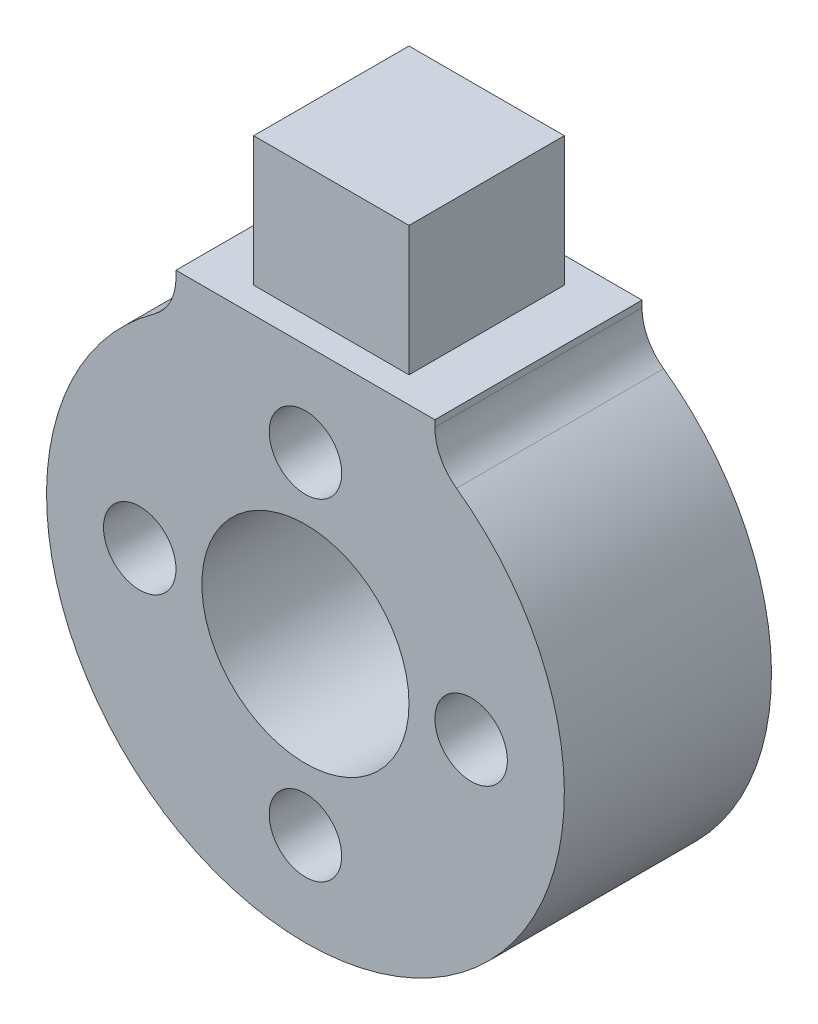
from build123d import *

# Parameters (mm, degrees)
SKETCH1_R           = 5.08
SKETCH1_R_2         = 1.778
BOSS_EXTRUDE1_DEPTH = 10.16
FILLET1_R           = 2.54
SKETCH2_W           = 7.62
SKETCH2_H           = 7.62
BOSS_EXTRUDE3_DEPTH = 6.35


with BuildPart() as part:
    # Sketch1 → Boss-Extrude1 (new body)
    with BuildSketch(Plane.XY):
        with BuildLine():
            Line((-6.35, 12.7), (-6.35, 10.998522628))
            ThreePointArc((-6.35, 10.998522628), (0, -12.7), (6.35, 10.998522628))
            Line((6.35, 10.998522628), (6.35, 12.7))
            Line((6.35, 12.7), (-6.35, 12.7))
        make_face()
        Circle(SKETCH1_R, mode=Mode.SUBTRACT)
        with Locations((0, 8.128)):
            Circle(SKETCH1_R_2, mode=Mode.SUBTRACT)
        with Locations((8.128, 0)):
            Circle(SKETCH1_R_2, mode=Mode.SUBTRACT)
        with Locations((0, -8.128)):
            Circle(SKETCH1_R_2, mode=Mode.SUBTRACT)
        with Locations((-8.128, 0)):
            Circle(SKETCH1_R_2, mode=Mode.SUBTRACT)
    extrude(amount=BOSS_EXTRUDE1_DEPTH)

    # Fillet1
    fillet1_edges = [part.edges().sort_by_distance(p)[0] for p in [
        (-6.35, 10.998522628, 5.08),
        (6.35, 10.998522628, 5.08),
    ]]
    fillet(fillet1_edges, radius=FILLET1_R)

    # Sketch2 → Boss-Extrude3 (add)
    with BuildSketch(Plane(origin=(0, 12.7, 0), x_dir=(1, 0, 0), z_dir=(0, 1, 0))):
        with Locations((0, -5.08)):
            Rectangle(SKETCH2_W, SKETCH2_H)
    extrude(amount=BOSS_EXTRUDE3_DEPTH)


solid = part.part
